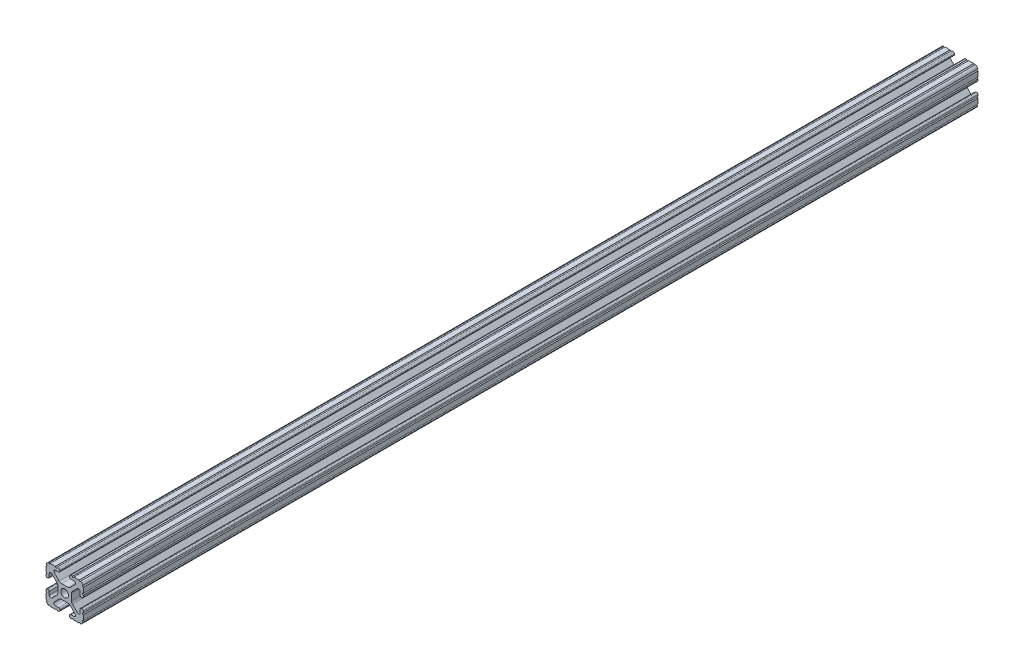
from build123d import *

# Parameters (mm, degrees)
BOSS_EXTRUDE1_DEPTH     = 304.8
CUT_EXTRUDE1_DEPTH      = 306.328708116
CUT_EXTRUDE1_DEPTH_BACK = 306.328708116
SKETCH5_R               = 0.55245
SKETCH6_R               = 3.2639
CUT_EXTRUDE2_DEPTH      = 307.120058147
SKETCH8_R               = 3.2639
CUT_EXTRUDE3_DEPTH      = 307.120058255


with BuildPart() as part:
    # Sketch4 → Boss-Extrude1 (new, symmetric)
    with BuildSketch(Plane.XY):
        with BuildLine():
            Line((4.190365, -12.7), (10.11729625, -12.7))
            ThreePointArc((10.11729625, -12.7), (11.943543585, -11.943543585), (12.7, -10.11729625))
            Line((12.7, -10.11729625), (12.7, -4.190365))
            ThreePointArc((12.7, -4.190365), (12.42492494, -3.52627506), (11.760835, -3.2512))
            Line((11.760835, -3.2512), (11.429365, -3.2512))
            ThreePointArc((11.429365, -3.2512), (10.76527506, -3.52627506), (10.4902, -4.190365))
            Line((10.4902, -4.190365), (10.4902, -6.348478019))
            ThreePointArc((10.4902, -6.348478019), (9.830707141, -7.335478831), (8.666460301, -7.103895736))
            Line((8.666460301, -7.103895736), (5.299899128, -3.737334563))
            ThreePointArc((5.299899128, -3.737334563), (4.817571085, -3.015479634), (4.6482, -2.16399369))
            Line((4.6482, -2.16399369), (4.6482, 0))
            Line((4.6482, 0), (2.6035, 0))
            ThreePointArc((2.6035, 0), (1.840952505, -1.840952505), (0, -2.6035))
            Line((0, -2.6035), (0, -4.6482))
            Line((0, -4.6482), (2.16399369, -4.6482))
            ThreePointArc((2.16399369, -4.6482), (3.015479634, -4.817571085), (3.737334563, -5.299899128))
            Line((3.737334563, -5.299899128), (7.103895736, -8.666460301))
            ThreePointArc((7.103895736, -8.666460301), (7.335478831, -9.830707141), (6.348478019, -10.4902))
            Line((6.348478019, -10.4902), (4.190365, -10.4902))
            ThreePointArc((4.190365, -10.4902), (3.52627506, -10.76527506), (3.2512, -11.429365))
            Line((3.2512, -11.429365), (3.2512, -11.760835))
            ThreePointArc((3.2512, -11.760835), (3.52627506, -12.42492494), (4.190365, -12.7))
        make_face()
    extrude(amount=BOSS_EXTRUDE1_DEPTH, both=True)

    # Sketch5 → Cut-Extrude1 (cut, two sides: drawn at the far end of the back side and taken through both)
    with BuildSketch(Plane.XY.offset(-CUT_EXTRUDE1_DEPTH_BACK)):
        with Locations((10.356153152, -12.7)):
            Circle(SKETCH5_R)
        with Locations((5.796028019, -12.7)):
            Circle(SKETCH5_R)
        with Locations((12.7, -10.356153152)):
            Circle(SKETCH5_R)
        with Locations((12.7, -5.796028019)):
            Circle(SKETCH5_R)
    extrude(amount=CUT_EXTRUDE1_DEPTH + CUT_EXTRUDE1_DEPTH_BACK, mode=Mode.SUBTRACT)

    # Mirror1: part across plane


with BuildPart() as part_1:
    add(part.part)
    add(part.part.mirror(Plane(origin=(0, 0, 0), x_dir=(0, 0, 1), z_dir=(1, 0, 0))))

    # Mirror2: part across plane


with BuildPart() as part_2:
    add(part_1.part)
    add(part_1.part.mirror(Plane.ZX))

    # Sketch6 → Cut-Extrude2 (cut, through all)
    with BuildSketch(Plane(origin=(0, 12.7, 0), x_dir=(1, 0, 0), z_dir=(0, 1, 0))):
        with Locations(Location((0, 292.220003133, 0), (0, 0, 311.529729521))):
            Circle(SKETCH6_R)
    extrude(amount=-CUT_EXTRUDE2_DEPTH, mode=Mode.SUBTRACT)

    # Sketch8 → Cut-Extrude3 (cut, through all)
    with BuildSketch(Plane(origin=(0, 12.7, 0), x_dir=(1, 0, 0), z_dir=(0, 1, 0))):
        with Locations(Location((0, 166.136933709, 0), (0, 0, 228.470270479))):
            Circle(SKETCH8_R)
        with Locations(Location((0, -138.663066291, 0), (0, 0, 228.470270479))):
            Circle(SKETCH8_R)
    extrude(amount=-CUT_EXTRUDE3_DEPTH, mode=Mode.SUBTRACT)


solid = part_2.part
